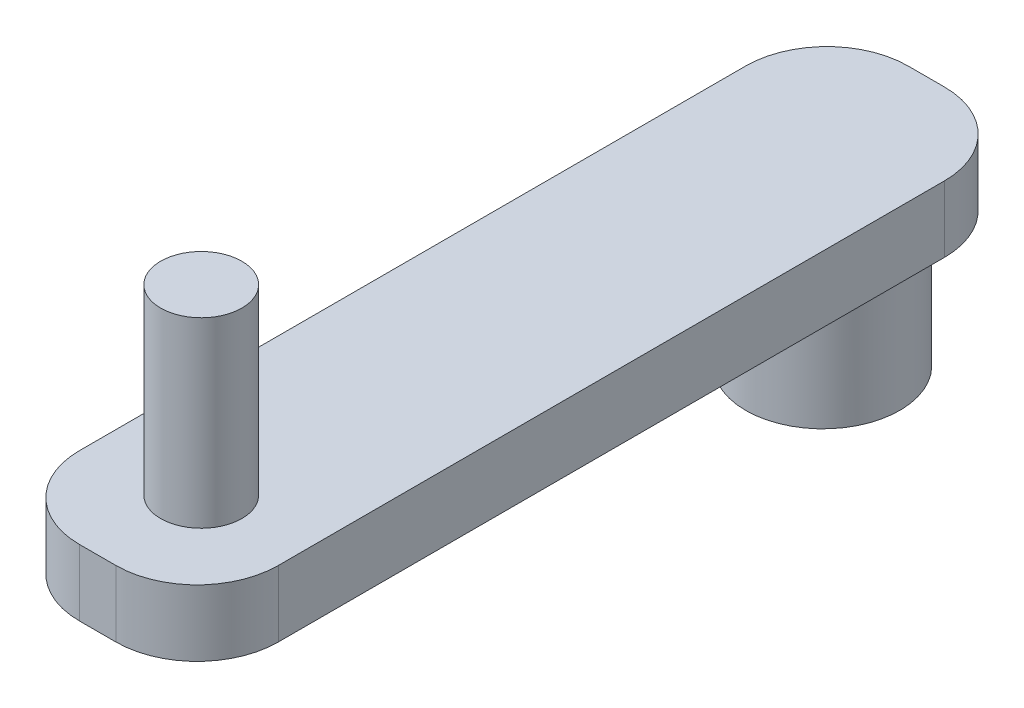
from build123d import *

# Parameters (mm, degrees)
BOSS_EXTRUDE1_DEPTH = 4
SKETCH2_3_R         = 4.65
BOSS_EXTRUDE2_DEPTH = 8
SKETCH2_4_R         = 2.45
BOSS_EXTRUDE3_DEPTH = 15


with BuildPart() as part:
    # Sketch2 → Boss-Extrude1 (new body)
    with BuildSketch(Plane(origin=(0, 0, 0), x_dir=(1, 0, 0), z_dir=(0, 1, 0))):
        with BuildLine():
            Line((-1.1, -25), (1.1, -25))
            ThreePointArc((1.1, -25), (4.564823228, -23.564823228), (6, -20.1))
            Line((6, -20.1), (6, 20.1))
            ThreePointArc((6, 20.1), (4.564823228, 23.564823228), (1.1, 25))
            Line((1.1, 25), (-1.1, 25))
            ThreePointArc((-1.1, 25), (-4.564823228, 23.564823228), (-6, 20.1))
            Line((-6, 20.1), (-6, -20.1))
            ThreePointArc((-6, -20.1), (-4.564823228, -23.564823228), (-1.1, -25))
        make_face()
    extrude(amount=BOSS_EXTRUDE1_DEPTH)

    # Sketch2<3> → Boss-Extrude2 (add)
    with BuildSketch(Plane(origin=(0, 0, 0), x_dir=(1, 0, 0), z_dir=(0, 1, 0))):
        with Locations((0, 18.75)):
            Circle(SKETCH2_3_R)
    extrude(amount=-BOSS_EXTRUDE2_DEPTH)

    # Sketch2<4> → Boss-Extrude3 (add)
    with BuildSketch(Plane(origin=(0, 0, 0), x_dir=(1, 0, 0), z_dir=(0, 1, 0))):
        with Locations((0, -18.75)):
            Circle(SKETCH2_4_R)
    extrude(amount=BOSS_EXTRUDE3_DEPTH)


solid = part.part
